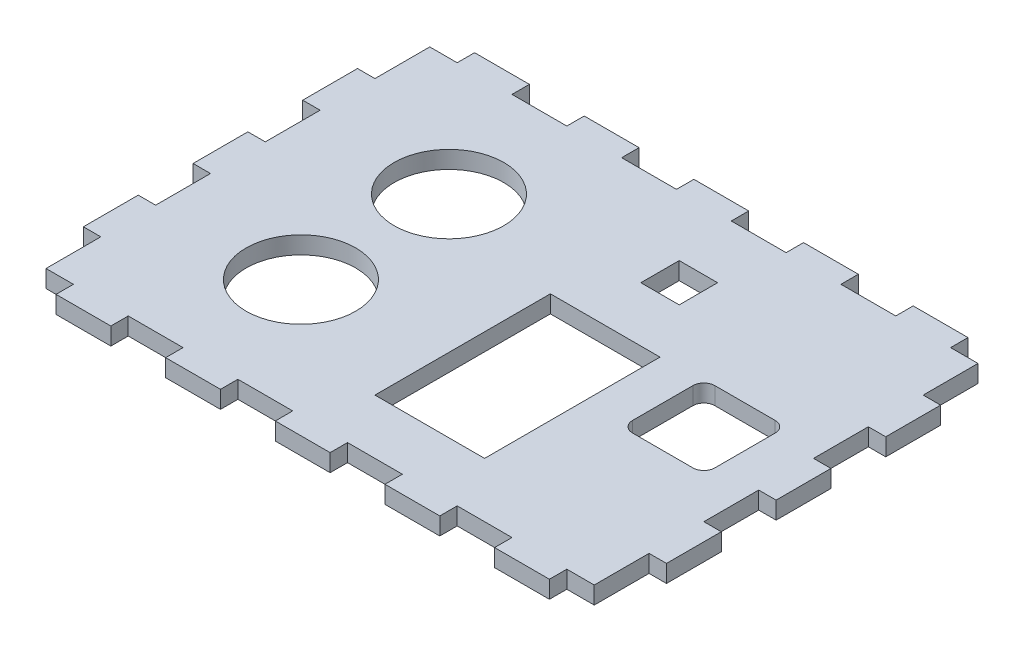
from build123d import *

# Parameters (mm, degrees)
SKETCH1_W                 = 100
SKETCH1_H                 = 70
BOSS_EXTRUDE1_DEPTH       = 3.175
SKETCH3_W                 = 3.175
SKETCH3_H                 = 10
SKETCH3_W_2               = 10
SKETCH3_H_2               = 3.175
BOSS_EXTRUDE2_DEPTH       = 3.175
MIRROR2_COPY_1_SKETCH_W   = 3.175
MIRROR2_COPY_1_SKETCH_H   = 10
MIRROR2_COPY_1_SKETCH_W_2 = 10
MIRROR2_COPY_1_SKETCH_H_2 = 3.175
MIRROR2_COPY_1_DEPTH      = 3.175
MIRROR2_COPY_2_SKETCH_W   = 3.175
MIRROR2_COPY_2_SKETCH_H   = 10
MIRROR2_COPY_2_SKETCH_W_2 = 10
MIRROR2_COPY_2_SKETCH_H_2 = 3.175
MIRROR2_COPY_2_DEPTH      = 3.175
CUT_EXTRUDE1_DEPTH        = 127.529608689
CUT_EXTRUDE1_DEPTH_BACK   = 127.529608689
SKETCH4_W                 = 20
SKETCH4_H                 = 32
SKETCH4_W_2               = 7
SKETCH4_H_2               = 7
SKETCH4_W_3               = 15
SKETCH4_H_3               = 15
FILLET1_R                 = 2
CUT_EXTRUDE2_DEPTH        = 127.529608689
CUT_EXTRUDE2_DEPTH_BACK   = 127.529608689
SKETCH5_R                 = 10


with BuildPart() as part:
    # Sketch1 → Boss-Extrude1 (new body)
    with BuildSketch(Plane(origin=(0, 0, 0), x_dir=(1, 0, 0), z_dir=(0, 1, 0))):
        with Locations((50, 35)):
            Rectangle(SKETCH1_W, SKETCH1_H)
    extrude(amount=BOSS_EXTRUDE1_DEPTH)

    # Sketch3 → Boss-Extrude2 (add)
    with BuildSketch(Plane(origin=(0, 0, 0), x_dir=(1, 0, 0), z_dir=(0, 1, 0))):
        with Locations((-1.5875, 55)):
            Rectangle(SKETCH3_W, SKETCH3_H)
        with Locations((-1.5875, 35)):
            Rectangle(SKETCH3_W, SKETCH3_H)
        with Locations((-1.5875, 15)):
            Rectangle(SKETCH3_W, SKETCH3_H)
        with Locations((30, 71.5875)):
            Rectangle(SKETCH3_W_2, SKETCH3_H_2)
        with Locations((70, 71.5875)):
            Rectangle(SKETCH3_W_2, SKETCH3_H_2)
        with Locations((90, 71.5875)):
            Rectangle(SKETCH3_W_2, SKETCH3_H_2)
        with Locations((10, 71.5875)):
            Rectangle(SKETCH3_W_2, SKETCH3_H_2)
        with Locations((50, 71.5875)):
            Rectangle(SKETCH3_W_2, SKETCH3_H_2)
    boss_extrude2 = extrude(amount=BOSS_EXTRUDE2_DEPTH)

    # Mirror1: Boss-Extrude2 across plane
    add(boss_extrude2.mirror(Plane(origin=(50, 0, 0), x_dir=(0, 0, 1), z_dir=(1, 0, 0))))

    # Mirror2 copy 1 sketch → Mirror2 copy 1 (add)
    with BuildSketch(Plane(origin=(100, 0, -70), x_dir=(-1, 0, 0), z_dir=(0, 1, 0))):
        with Locations((-1.5875, 55)):
            Rectangle(MIRROR2_COPY_1_SKETCH_W, MIRROR2_COPY_1_SKETCH_H)
        with Locations((-1.5875, 35)):
            Rectangle(MIRROR2_COPY_1_SKETCH_W, MIRROR2_COPY_1_SKETCH_H)
        with Locations((-1.5875, 15)):
            Rectangle(MIRROR2_COPY_1_SKETCH_W, MIRROR2_COPY_1_SKETCH_H)
        with Locations((30, 71.5875)):
            Rectangle(MIRROR2_COPY_1_SKETCH_W_2, MIRROR2_COPY_1_SKETCH_H_2)
        with Locations((70, 71.5875)):
            Rectangle(MIRROR2_COPY_1_SKETCH_W_2, MIRROR2_COPY_1_SKETCH_H_2)
        with Locations((90, 71.5875)):
            Rectangle(MIRROR2_COPY_1_SKETCH_W_2, MIRROR2_COPY_1_SKETCH_H_2)
        with Locations((10, 71.5875)):
            Rectangle(MIRROR2_COPY_1_SKETCH_W_2, MIRROR2_COPY_1_SKETCH_H_2)
        with Locations((50, 71.5875)):
            Rectangle(MIRROR2_COPY_1_SKETCH_W_2, MIRROR2_COPY_1_SKETCH_H_2)
    extrude(amount=MIRROR2_COPY_1_DEPTH)

    # Mirror2 copy 2 sketch → Mirror2 copy 2 (add)
    with BuildSketch(Plane(origin=(0, 0, -70), x_dir=(1, 0, 0), z_dir=(0, 1, 0))):
        with Locations((-1.5875, -55)):
            Rectangle(MIRROR2_COPY_2_SKETCH_W, MIRROR2_COPY_2_SKETCH_H)
        with Locations((-1.5875, -35)):
            Rectangle(MIRROR2_COPY_2_SKETCH_W, MIRROR2_COPY_2_SKETCH_H)
        with Locations((-1.5875, -15)):
            Rectangle(MIRROR2_COPY_2_SKETCH_W, MIRROR2_COPY_2_SKETCH_H)
        with Locations((30, -71.5875)):
            Rectangle(MIRROR2_COPY_2_SKETCH_W_2, MIRROR2_COPY_2_SKETCH_H_2)
        with Locations((70, -71.5875)):
            Rectangle(MIRROR2_COPY_2_SKETCH_W_2, MIRROR2_COPY_2_SKETCH_H_2)
        with Locations((90, -71.5875)):
            Rectangle(MIRROR2_COPY_2_SKETCH_W_2, MIRROR2_COPY_2_SKETCH_H_2)
        with Locations((10, -71.5875)):
            Rectangle(MIRROR2_COPY_2_SKETCH_W_2, MIRROR2_COPY_2_SKETCH_H_2)
        with Locations((50, -71.5875)):
            Rectangle(MIRROR2_COPY_2_SKETCH_W_2, MIRROR2_COPY_2_SKETCH_H_2)
    extrude(amount=MIRROR2_COPY_2_DEPTH)

    # Sketch4 → Cut-Extrude1 (cut, two sides: drawn at the far end of the back side and taken through both)
    with BuildSketch(Plane.XZ.offset(-CUT_EXTRUDE1_DEPTH_BACK)):
        with Locations((60, -26)):
            Rectangle(SKETCH4_W, SKETCH4_H)
        with Locations((60, -55.5)):
            Rectangle(SKETCH4_W_2, SKETCH4_H_2)
        with Locations((85, -35)):
            Rectangle(SKETCH4_W_3, SKETCH4_H_3)
    extrude(amount=CUT_EXTRUDE1_DEPTH + CUT_EXTRUDE1_DEPTH_BACK, mode=Mode.SUBTRACT)

    # Fillet1
    fillet1_edges = [part.edges().sort_by_distance(p)[0] for p in [
        (77.5, 1.5875, -42.5),
        (77.5, 1.5875, -27.5),
        (92.5, 1.5875, -27.5),
        (92.5, 1.5875, -42.5),
    ]]
    fillet(fillet1_edges, radius=FILLET1_R)

    # Sketch5 → Cut-Extrude2 (cut, two sides: drawn at the far end of the back side and taken through both)
    with BuildSketch(Plane.XZ.offset(-CUT_EXTRUDE2_DEPTH_BACK)):
        with Locations(Location((25, -48.5, 0), (0, 0, 270))):
            Circle(SKETCH5_R)
        with Locations(Location((25, -21.5, 0), (0, 0, 270))):
            Circle(SKETCH5_R)
    extrude(amount=CUT_EXTRUDE2_DEPTH + CUT_EXTRUDE2_DEPTH_BACK, mode=Mode.SUBTRACT)


solid = part.part
